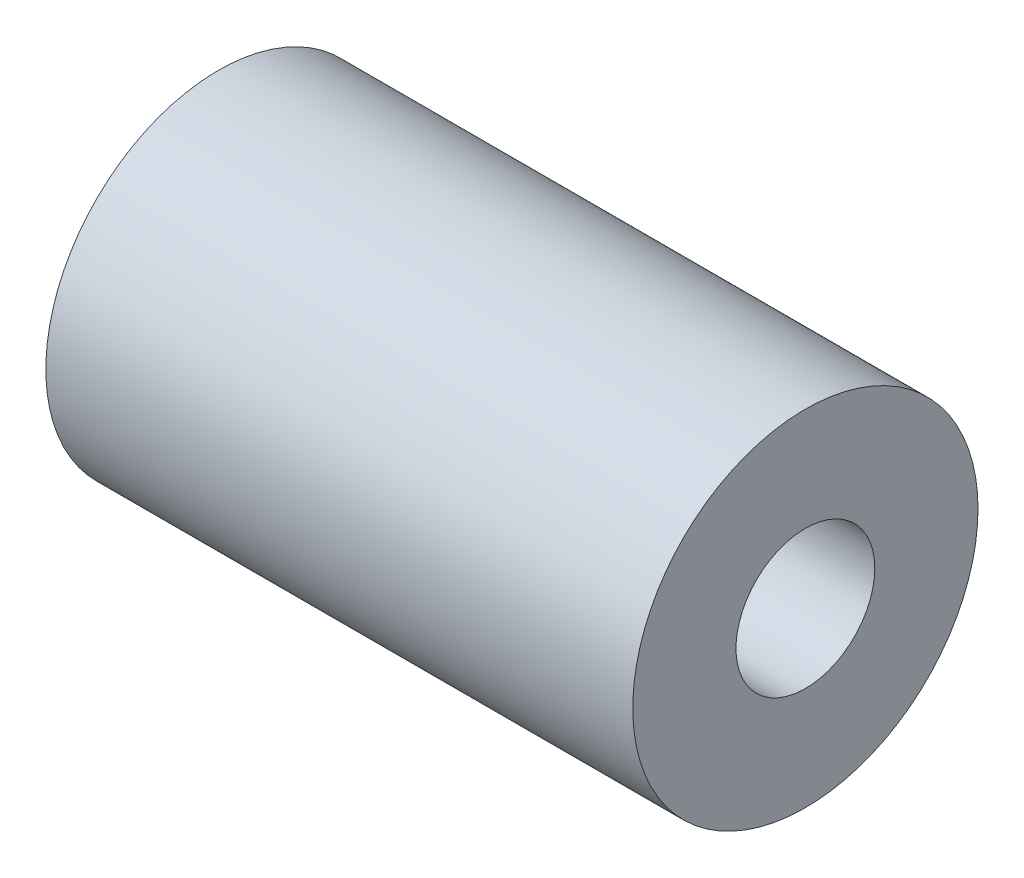
from build123d import *

# Parameters (mm, degrees)
SKETCH1_R           = 6.35
SKETCH1_R_2         = 2.5527
BOSS_EXTRUDE1_DEPTH = 21.59


with BuildPart() as part:
    # Sketch1 → Boss-Extrude1 (new body)
    with BuildSketch(Plane(origin=(0, 0, 0), x_dir=(0, 0, -1), z_dir=(1, 0, 0))):
        Circle(SKETCH1_R)
        Circle(SKETCH1_R_2, mode=Mode.SUBTRACT)
    extrude(amount=BOSS_EXTRUDE1_DEPTH)


solid = part.part
